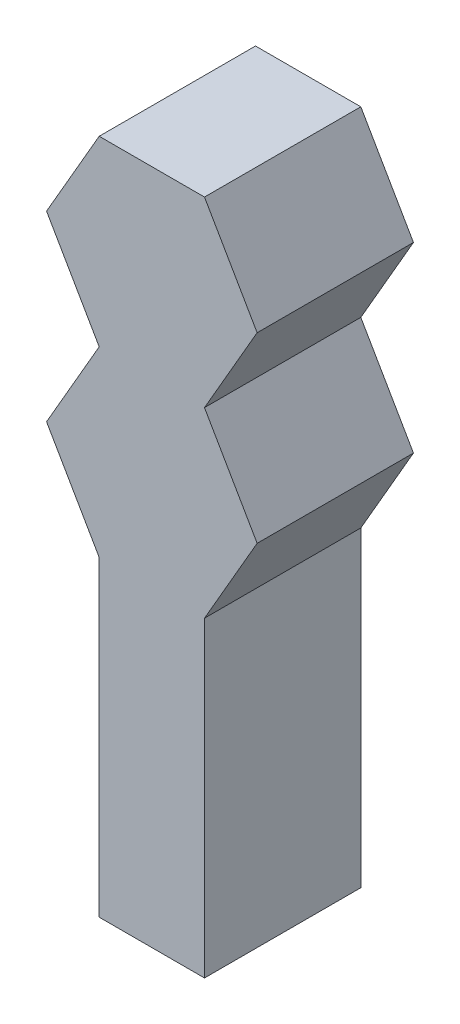
from build123d import *

# Parameters (mm, degrees)
BOSS_EXTRUDE1_DEPTH = 3


with BuildPart() as part:
    # Sketch1 → Boss-Extrude1 (new body)
    with BuildSketch(Plane.XY):
        Polygon((0, 0), (2.020726, 0), (2.020726, 5.98), (3.031089, 7.73000005), (2.020726, 9.4800001), (3.031089, 11.23000015), (2.020726, 12.9800002), (0, 12.9800002), (-1.010363, 11.23000015), (0, 9.4800001), (-1.010363, 7.73000005), (0, 5.98), align=None)
    extrude(amount=BOSS_EXTRUDE1_DEPTH)


solid = part.part
